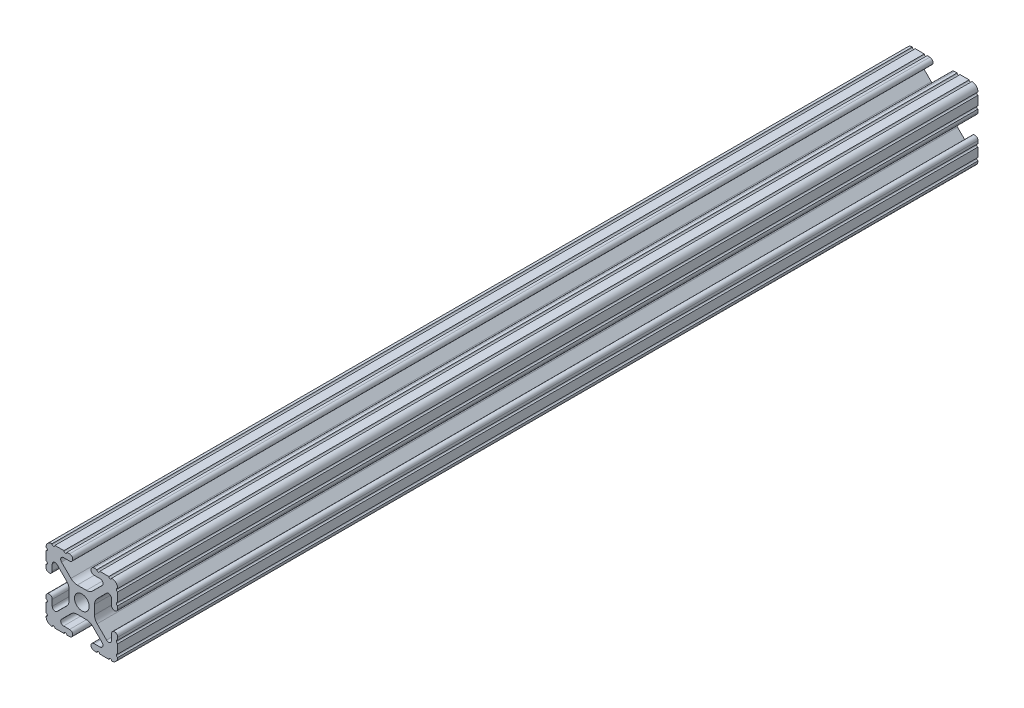
from build123d import *

# Parameters (mm, degrees)
SKETCH1_R           = 2.6035
BOSS_EXTRUDE1_DEPTH = 304.8


with BuildPart() as part:
    # Sketch1 → Boss-Extrude1 (new body)
    with BuildSketch(Plane(origin=(0, 0, -25.4), x_dir=(-1, 0, 0), z_dir=(0, 0, -1))):
        with BuildLine():
            Line((12.7, -9.5504), (12.7, -6.3330836))
            ThreePointArc((12.7, -6.3330836), (12.192, -5.8250836), (12.7, -5.3170836))
            Line((12.7, -5.3170836), (12.7, -4.3434))
            ThreePointArc((12.7, -4.3434), (11.5951, -3.2385), (10.4902, -4.3434))
            Line((10.4902, -4.3434), (10.4902, -6.474794456))
            ThreePointArc((10.4902, -6.474794456), (9.863006367, -7.413456061), (8.75577951, -7.193214945))
            Line((8.75577951, -7.193214945), (5.42573597, -3.863171405))
            ThreePointArc((5.42573597, -3.863171405), (4.737482484, -2.833127272), (4.4958, -1.618107374))
            Line((4.4958, -1.618107374), (4.4958, 1.618107374))
            ThreePointArc((4.4958, 1.618107374), (4.737482484, 2.833127272), (5.42573597, 3.863171405))
            Line((5.42573597, 3.863171405), (8.75577951, 7.193214945))
            ThreePointArc((8.75577951, 7.193214945), (9.863006367, 7.413456061), (10.4902, 6.474794456))
            Line((10.4902, 6.474794456), (10.4902, 4.343399971))
            ThreePointArc((10.4902, 4.343399971), (11.5951, 3.238499971), (12.7, 4.343399971))
            Line((12.7, 4.343399971), (12.7, 5.3170836))
            ThreePointArc((12.7, 5.3170836), (12.192, 5.8250836), (12.7, 6.3330836))
            Line((12.7, 6.3330836), (12.7, 9.5504))
            ThreePointArc((12.7, 9.5504), (12.192000006, 10.058323491), (12.699846982, 10.566399977))
            ThreePointArc((12.699846982, 10.566399977), (12.082522516, 12.082522516), (10.566399977, 12.699846982))
            ThreePointArc((10.566399977, 12.699846982), (10.058323491, 12.192000006), (9.5504, 12.7))
            Line((9.5504, 12.7), (6.3330836, 12.7))
            ThreePointArc((6.3330836, 12.7), (5.8250836, 12.192), (5.3170836, 12.7))
            Line((5.3170836, 12.7), (4.3434, 12.7))
            ThreePointArc((4.3434, 12.7), (3.2385, 11.5951), (4.3434, 10.4902))
            Line((4.3434, 10.4902), (6.474794456, 10.4902))
            ThreePointArc((6.474794456, 10.4902), (7.413456061, 9.863006367), (7.193214945, 8.75577951))
            Line((7.193214945, 8.75577951), (3.863171405, 5.42573597))
            ThreePointArc((3.863171405, 5.42573597), (2.833127272, 4.737482484), (1.618107374, 4.4958))
            Line((1.618107374, 4.4958), (-1.618107374, 4.4958))
            ThreePointArc((-1.618107374, 4.4958), (-2.833127272, 4.737482484), (-3.863171405, 5.42573597))
            Line((-3.863171405, 5.42573597), (-7.193214945, 8.75577951))
            ThreePointArc((-7.193214945, 8.75577951), (-7.413456061, 9.863006367), (-6.474794456, 10.4902))
            Line((-6.474794456, 10.4902), (-4.343399971, 10.4902))
            ThreePointArc((-4.343399971, 10.4902), (-3.238499971, 11.5951), (-4.343399971, 12.7))
            Line((-4.343399971, 12.7), (-5.3170836, 12.7))
            ThreePointArc((-5.3170836, 12.7), (-5.8250836, 12.192), (-6.3330836, 12.7))
            Line((-6.3330836, 12.7), (-9.5504, 12.7))
            ThreePointArc((-9.5504, 12.7), (-10.058323491, 12.192000006), (-10.566399977, 12.699846982))
            ThreePointArc((-10.566399977, 12.699846982), (-12.082522516, 12.082522516), (-12.699846982, 10.566399977))
            ThreePointArc((-12.699846982, 10.566399977), (-12.192000006, 10.058323491), (-12.7, 9.5504))
            Line((-12.7, 9.5504), (-12.7, 6.3330836))
            ThreePointArc((-12.7, 6.3330836), (-12.192, 5.8250836), (-12.7, 5.3170836))
            Line((-12.7, 5.3170836), (-12.7, 4.3434))
            ThreePointArc((-12.7, 4.3434), (-11.5951, 3.2385), (-10.4902, 4.3434))
            Line((-10.4902, 4.3434), (-10.4902, 6.474794456))
            ThreePointArc((-10.4902, 6.474794456), (-9.863006367, 7.413456061), (-8.75577951, 7.193214945))
            Line((-8.75577951, 7.193214945), (-5.42573597, 3.863171405))
            ThreePointArc((-5.42573597, 3.863171405), (-4.737482484, 2.833127272), (-4.4958, 1.618107374))
            Line((-4.4958, 1.618107374), (-4.4958, -1.618107374))
            ThreePointArc((-4.4958, -1.618107374), (-4.737482484, -2.833127272), (-5.42573597, -3.863171405))
            Line((-5.42573597, -3.863171405), (-8.75577951, -7.193214945))
            ThreePointArc((-8.75577951, -7.193214945), (-9.863006367, -7.413456061), (-10.4902, -6.474794456))
            Line((-10.4902, -6.474794456), (-10.4902, -4.343399971))
            ThreePointArc((-10.4902, -4.343399971), (-11.5951, -3.238499971), (-12.7, -4.343399971))
            Line((-12.7, -4.343399971), (-12.7, -5.3170836))
            ThreePointArc((-12.7, -5.3170836), (-12.192, -5.8250836), (-12.7, -6.3330836))
            Line((-12.7, -6.3330836), (-12.7, -9.5504))
            ThreePointArc((-12.7, -9.5504), (-12.192000006, -10.058323491), (-12.699846982, -10.566399977))
            ThreePointArc((-12.699846982, -10.566399977), (-12.082522516, -12.082522516), (-10.566399977, -12.699846982))
            ThreePointArc((-10.566399977, -12.699846982), (-10.058323491, -12.192000006), (-9.5504, -12.7))
            Line((-9.5504, -12.7), (-6.3330836, -12.7))
            ThreePointArc((-6.3330836, -12.7), (-5.8250836, -12.192), (-5.3170836, -12.7))
            Line((-5.3170836, -12.7), (-4.3434, -12.7))
            ThreePointArc((-4.3434, -12.7), (-3.2385, -11.5951), (-4.3434, -10.4902))
            Line((-4.3434, -10.4902), (-6.474794456, -10.4902))
            ThreePointArc((-6.474794456, -10.4902), (-7.413456061, -9.863006367), (-7.193214945, -8.75577951))
            Line((-7.193214945, -8.75577951), (-3.863171405, -5.42573597))
            ThreePointArc((-3.863171405, -5.42573597), (-2.833127272, -4.737482484), (-1.618107374, -4.4958))
            Line((-1.618107374, -4.4958), (1.618107374, -4.4958))
            ThreePointArc((1.618107374, -4.4958), (2.833127272, -4.737482484), (3.863171405, -5.42573597))
            Line((3.863171405, -5.42573597), (7.193214945, -8.75577951))
            ThreePointArc((7.193214945, -8.75577951), (7.413456061, -9.863006367), (6.474794456, -10.4902))
            Line((6.474794456, -10.4902), (4.343399971, -10.4902))
            ThreePointArc((4.343399971, -10.4902), (3.238499971, -11.5951), (4.343399971, -12.7))
            Line((4.343399971, -12.7), (5.3170836, -12.7))
            ThreePointArc((5.3170836, -12.7), (5.8250836, -12.192), (6.3330836, -12.7))
            Line((6.3330836, -12.7), (9.5504, -12.7))
            ThreePointArc((9.5504, -12.7), (10.058323491, -12.192000006), (10.566399977, -12.699846982))
            ThreePointArc((10.566399977, -12.699846982), (12.082522516, -12.082522516), (12.699846982, -10.566399977))
            ThreePointArc((12.699846982, -10.566399977), (12.192000006, -10.058323491), (12.7, -9.5504))
        make_face()
        with Locations(Location((0, 0, 0), (0, 0, 180))):
            Circle(SKETCH1_R, mode=Mode.SUBTRACT)
    extrude(amount=BOSS_EXTRUDE1_DEPTH)


solid = part.part
